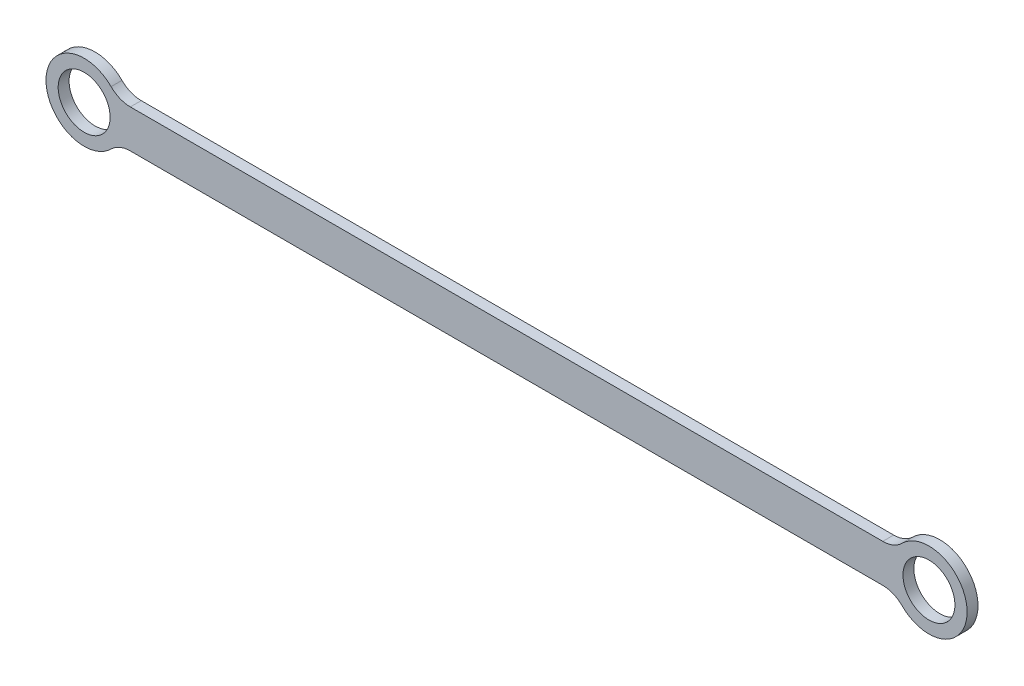
from build123d import *

# Parameters (mm, degrees)
SKETCH_2_R      = 9.53
EXTRUDE_2_DEPTH = 4


with BuildPart() as part:
    # 草图2 → 凸台-拉伸2 (new body)
    with BuildSketch(Plane.XY):
        with BuildLine():
            Line((-138.057525522, 6.998604606), (138.057525522, 6.998604606))
            ThreePointArc((138.057525522, 6.998604606), (141.876719207, 7.756648125), (145.116889888, 9.915852687))
            ThreePointArc((145.116889888, 9.915852687), (169, 0), (145.116889888, -9.915852687))
            ThreePointArc((145.116889888, -9.915852687), (141.876719207, -7.756648125), (138.057525522, -6.998604606))
            Line((138.057525522, -6.998604606), (-138.057525522, -6.998604606))
            ThreePointArc((-138.057525522, -6.998604606), (-141.876719207, -7.756648125), (-145.116889888, -9.915852687))
            ThreePointArc((-145.116889888, -9.915852687), (-169, 0), (-145.116889888, 9.915852687))
            ThreePointArc((-145.116889888, 9.915852687), (-141.876719207, 7.756648125), (-138.057525522, 6.998604606))
        make_face()
        with Locations((-155, 0)):
            Circle(SKETCH_2_R, mode=Mode.SUBTRACT)
        with Locations((155, 0)):
            Circle(SKETCH_2_R, mode=Mode.SUBTRACT)
    extrude(amount=EXTRUDE_2_DEPTH)


solid = part.part
